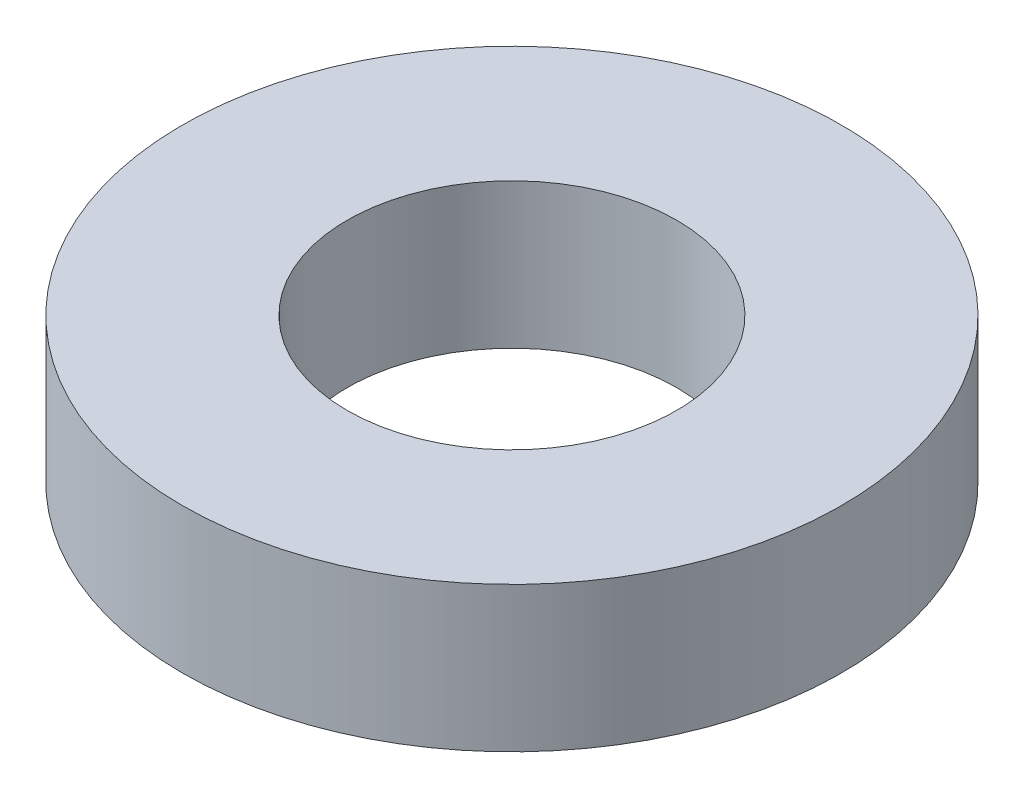
from build123d import *

# Parameters (mm, degrees)
SKETCH1_R           = 3
SKETCH1_R_2         = 1.5
BOSS_EXTRUDE1_DEPTH = 0.66


with BuildPart() as part:
    # Sketch1 → Boss-Extrude1 (new, symmetric)
    with BuildSketch(Plane(origin=(0, 0, 0), x_dir=(1, 0, 0), z_dir=(0, 1, 0))):
        with Locations(Location((0, 0, 0), (0, 0, 270))):
            Circle(SKETCH1_R)
        with Locations(Location((0, 0, 0), (0, 0, 270))):
            Circle(SKETCH1_R_2, mode=Mode.SUBTRACT)
    extrude(amount=BOSS_EXTRUDE1_DEPTH, both=True)


solid = part.part
